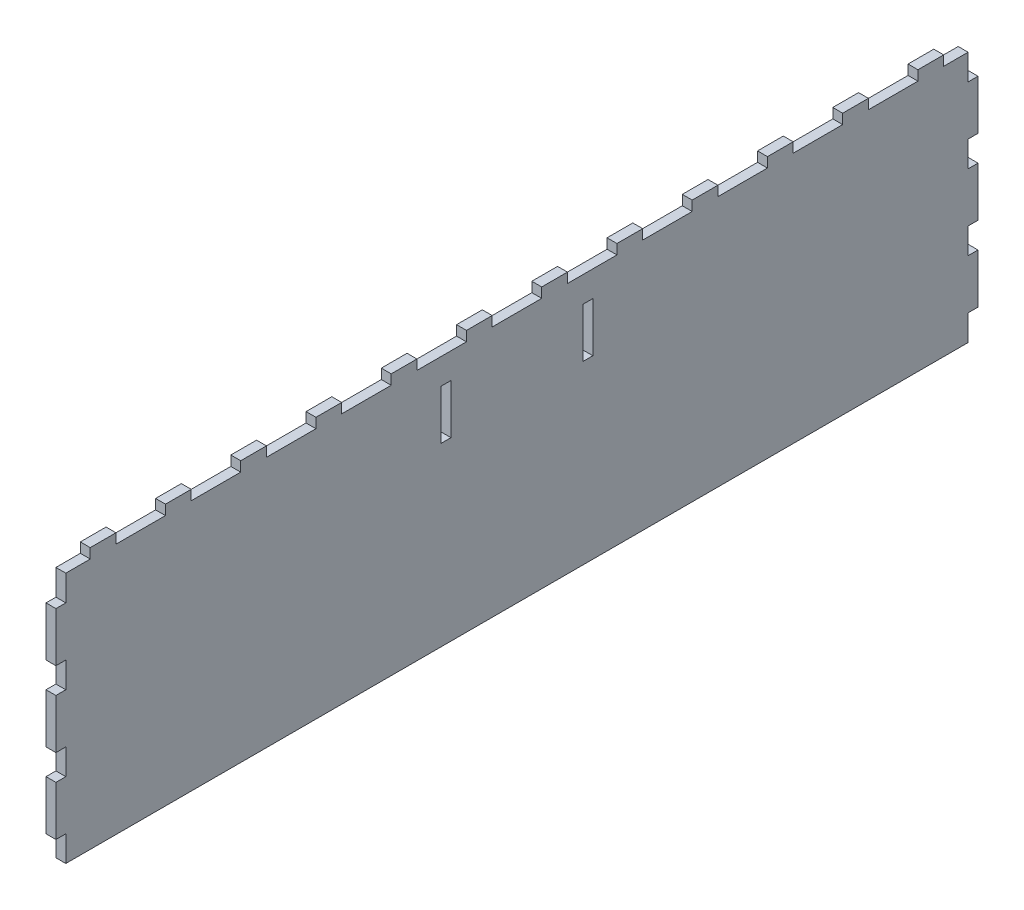
from build123d import *

# Parameters (mm, degrees)
SKETCH1_W               = 279.4
SKETCH1_H               = 76.2
BOSS_EXTRUDE1_DEPTH     = 3
SKETCH3_W               = 3
SKETCH3_H               = 7.8
CUT_EXTRUDE1_DEPTH      = 145.833352512
LPATTERN1_COUNT         = 4
LPATTERN1_PITCH         = 22.8
MIRROR1_COPY_1_SKETCH_W = 3
MIRROR1_COPY_1_SKETCH_H = 7.8
MIRROR1_COPY_1_DEPTH    = 145.833352512
MIRROR1_COPY_2_SKETCH_W = 3
MIRROR1_COPY_2_SKETCH_H = 7.8
MIRROR1_COPY_2_DEPTH    = 145.833352512
MIRROR1_COPY_3_SKETCH_W = 3
MIRROR1_COPY_3_SKETCH_H = 7.8
MIRROR1_COPY_3_DEPTH    = 145.833352512
SKETCH5_W               = 3
SKETCH5_H               = 15
CUT_EXTRUDE3_DEPTH      = 10
SKETCH9_W               = 3
SKETCH9_H               = 7.8
BOSS_EXTRUDE2_DEPTH     = 3
LPATTERN4_COUNT         = 12
LPATTERN4_PITCH         = 22.8


with BuildPart() as part:
    # Sketch1 → Boss-Extrude1 (new body)
    with BuildSketch(Plane(origin=(0, 0, 0), x_dir=(0, 0, -1), z_dir=(1, 0, 0))):
        Rectangle(SKETCH1_W, SKETCH1_H)
    extrude(amount=-BOSS_EXTRUDE1_DEPTH)

    # Sketch3 → Cut-Extrude1 (cut, through all)
    with BuildSketch(Plane.ZY.offset(3)):
        with Locations((-138.2, 34.2)):
            Rectangle(SKETCH3_W, SKETCH3_H)
    cut_extrude1 = extrude(amount=-CUT_EXTRUDE1_DEPTH, mode=Mode.SUBTRACT)

    # LPattern1: Cut-Extrude1 ×4
    with Locations(*[(0, -i * LPATTERN1_PITCH, 0) for i in range(1, LPATTERN1_COUNT)]):
        add(cut_extrude1, mode=Mode.SUBTRACT)

    # Mirror1: Cut-Extrude1 across plane
    add(cut_extrude1.mirror(Plane.XY), mode=Mode.SUBTRACT)

    # Mirror1 copy 1 sketch → Mirror1 copy 1 (cut, through all)
    with BuildSketch(Plane(origin=(-3, -22.8, 0), x_dir=(0, 0, -1), z_dir=(-1, 0, 0))):
        with Locations((-138.2, -34.2)):
            Rectangle(MIRROR1_COPY_1_SKETCH_W, MIRROR1_COPY_1_SKETCH_H)
    extrude(amount=-MIRROR1_COPY_1_DEPTH, mode=Mode.SUBTRACT)

    # Mirror1 copy 2 sketch → Mirror1 copy 2 (cut, through all)
    with BuildSketch(Plane(origin=(-3, -45.6, 0), x_dir=(0, 0, -1), z_dir=(-1, 0, 0))):
        with Locations((-138.2, -34.2)):
            Rectangle(MIRROR1_COPY_2_SKETCH_W, MIRROR1_COPY_2_SKETCH_H)
    extrude(amount=-MIRROR1_COPY_2_DEPTH, mode=Mode.SUBTRACT)

    # Mirror1 copy 3 sketch → Mirror1 copy 3 (cut, through all)
    with BuildSketch(Plane(origin=(-3, -68.4, 0), x_dir=(0, 0, -1), z_dir=(-1, 0, 0))):
        with Locations((-138.2, -34.2)):
            Rectangle(MIRROR1_COPY_3_SKETCH_W, MIRROR1_COPY_3_SKETCH_H)
    extrude(amount=-MIRROR1_COPY_3_DEPTH, mode=Mode.SUBTRACT)

    # Sketch5 → Cut-Extrude3 (cut)
    with BuildSketch(Plane.ZY.offset(3)):
        with Locations((-21.5, 22.8)):
            Rectangle(SKETCH5_W, SKETCH5_H)
    cut_extrude3 = extrude(amount=-CUT_EXTRUDE3_DEPTH, mode=Mode.SUBTRACT)

    # Mirror2: Cut-Extrude3 across plane
    add(cut_extrude3.mirror(Plane.XY), mode=Mode.SUBTRACT)

    # Sketch9 → Boss-Extrude2 (add)
    with BuildSketch(Plane(origin=(0, 38.1, 0), x_dir=(1, 0, 0), z_dir=(0, 1, 0))):
        with Locations((-1.5, 125.4)):
            Rectangle(SKETCH9_W, SKETCH9_H)
    boss_extrude2 = extrude(amount=BOSS_EXTRUDE2_DEPTH)

    # LPattern4: Boss-Extrude2 ×12
    with Locations(*[(0, 0, i * LPATTERN4_PITCH) for i in range(1, LPATTERN4_COUNT)]):
        add(boss_extrude2)


solid = part.part
